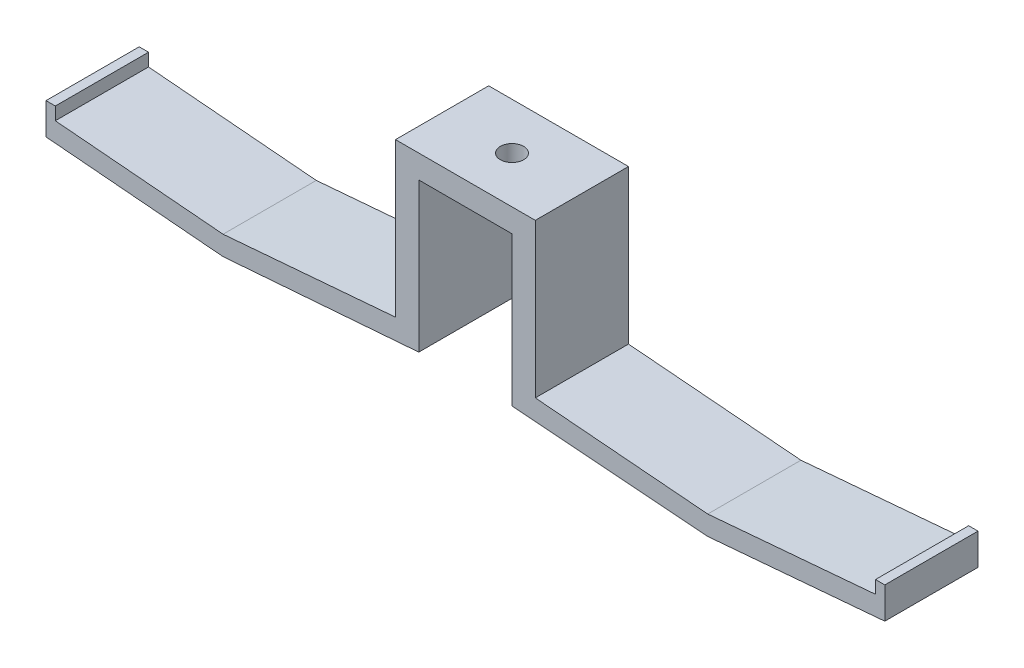
from build123d import *

# Parameters (mm, degrees)
BOSS_EXTRUDE1_DEPTH = 25.4
CUT_EXTRUDE1_REACH  = 129.762
SKETCH3_R           = 3.175


with BuildPart() as part:
    # Sketch2 → Boss-Extrude1 (new body)
    with BuildSketch(Plane.XY):
        Polygon((0, 0), (12.7, 0), (12.7, -40.64), (66.04, -44.773379719), (114.3, -40.64), (114.3, -32.073379719), (111.76, -32.073379719), (111.76, -35.56), (66.04, -39.475833418), (19.05, -35.56), (19.05, 0), (19.05, 6.35), (0, 6.35), align=None)
        Polygon((-12.7, 0), (0, 0), (0, 6.35), (-19.05, 6.35), (-19.05, 0), (-19.05, -35.56), (-66.04, -39.475833418), (-111.76, -35.56), (-111.76, -32.073379719), (-114.3, -32.073379719), (-114.3, -40.64), (-66.04, -44.773379719), (-12.7, -40.64), align=None)
    extrude(amount=BOSS_EXTRUDE1_DEPTH)

    # Sketch3 → Cut-Extrude1 (cut, up to next)
    with BuildSketch(Plane(origin=(0, 6.35, 0), x_dir=(1, 0, 0), z_dir=(0, 1, 0)), mode=Mode.PRIVATE) as cut_extrude1_sk1:
        with Locations(Location((0, -12.7, 0), (0, 0, 180))):
            Circle(SKETCH3_R)
    cut_extrude1_tool1 = extrude(cut_extrude1_sk1.sketch, amount=-CUT_EXTRUDE1_REACH, mode=Mode.PRIVATE) & part.part
    add(cut_extrude1_tool1.solids().sort_by_distance((0, 6.35, 12.7))[0], mode=Mode.SUBTRACT)


solid = part.part
